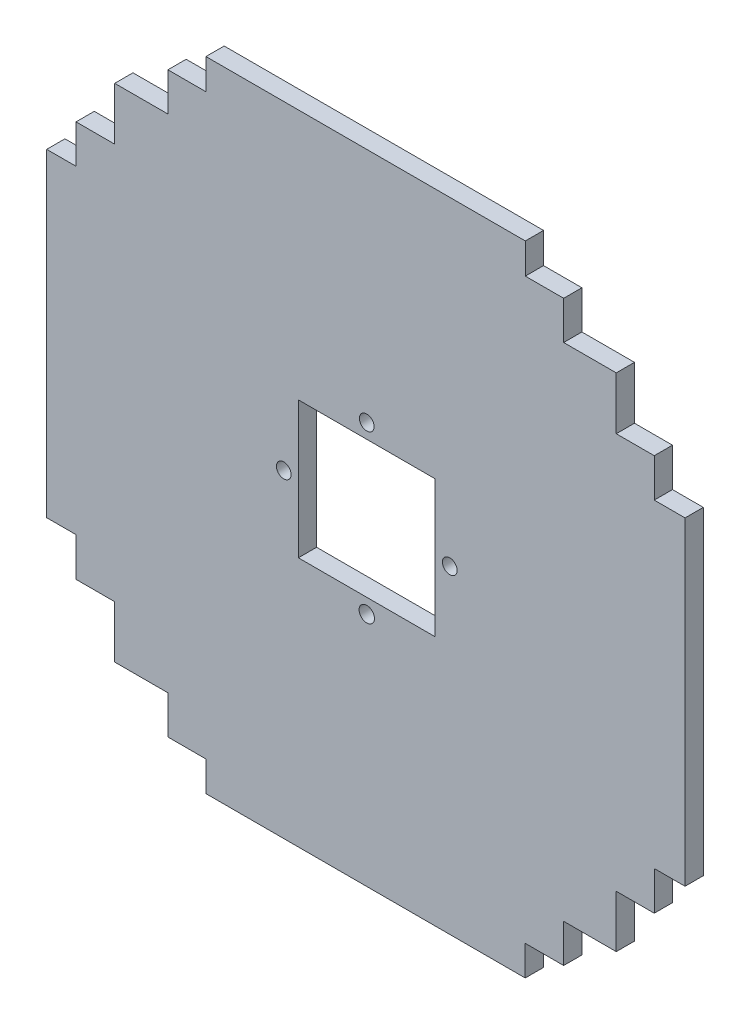
from build123d import *

# Parameters (mm, degrees)
SKETCH1_R           = 2.045707784
SKETCH1_R_2         = 2.13337502
SKETCH1_W           = 38.1
SKETCH1_H           = 38.1
BOSS_EXTRUDE3_DEPTH = 5.08


with BuildPart() as part:
    # Sketch1 → Boss-Extrude3 (new body)
    with BuildSketch(Plane.XY):
        Polygon((-83.014795154, 130.420630372), (5.943060379, 130.420630372), (5.943060379, 121.930337924), (16.626041869, 121.930337924), (16.626041869, 111.260143372), (31.269563819, 111.260143372), (31.269563819, 96.576116387), (41.855511127, 96.576116387), (41.855511127, 85.860143372), (50.436103152, 85.860143372), (50.436103152, -2.997954724), (41.855511127, -2.997954724), (41.855511127, -13.785983185), (31.269563819, -13.785983185), (31.269563819, -28.34797266), (16.626041869, -28.34797266), (16.626041869, -39.015452444), (5.9203896, -39.015452444), (5.9203896, -47.379369628), (-83.037465933, -47.379369628), (-83.037465933, -39.015452444), (-93.601982027, -39.015452444), (-93.601982027, -28.34797266), (-108.414795154, -28.34797266), (-108.414795154, -13.785983185), (-119.192241536, -13.785983185), (-119.192241536, -2.997954724), (-127.363896848, -2.997954724), (-127.363896848, 85.860143372), (-119.192241536, 85.860143372), (-119.192241536, 96.576116387), (-108.414795154, 96.576116387), (-108.414795154, 111.260143372), (-93.601982027, 111.260143372), (-93.601982027, 121.930337924), (-83.014795154, 121.930337924), align=None)
        with Locations((-61.329510567, 41.431094324)):
            Circle(SKETCH1_R, mode=Mode.SUBTRACT)
        with Locations((-38.215510567, 64.545094324)):
            Circle(SKETCH1_R, mode=Mode.SUBTRACT)
        with Locations((-15.101510567, 41.431094324)):
            Circle(SKETCH1_R, mode=Mode.SUBTRACT)
        with Locations((-38.215510567, 18.317094324)):
            Circle(SKETCH1_R_2, mode=Mode.SUBTRACT)
        with Locations((-38.215510567, 41.431094324)):
            Rectangle(SKETCH1_W, SKETCH1_H, mode=Mode.SUBTRACT)
    extrude(amount=BOSS_EXTRUDE3_DEPTH)


solid = part.part
